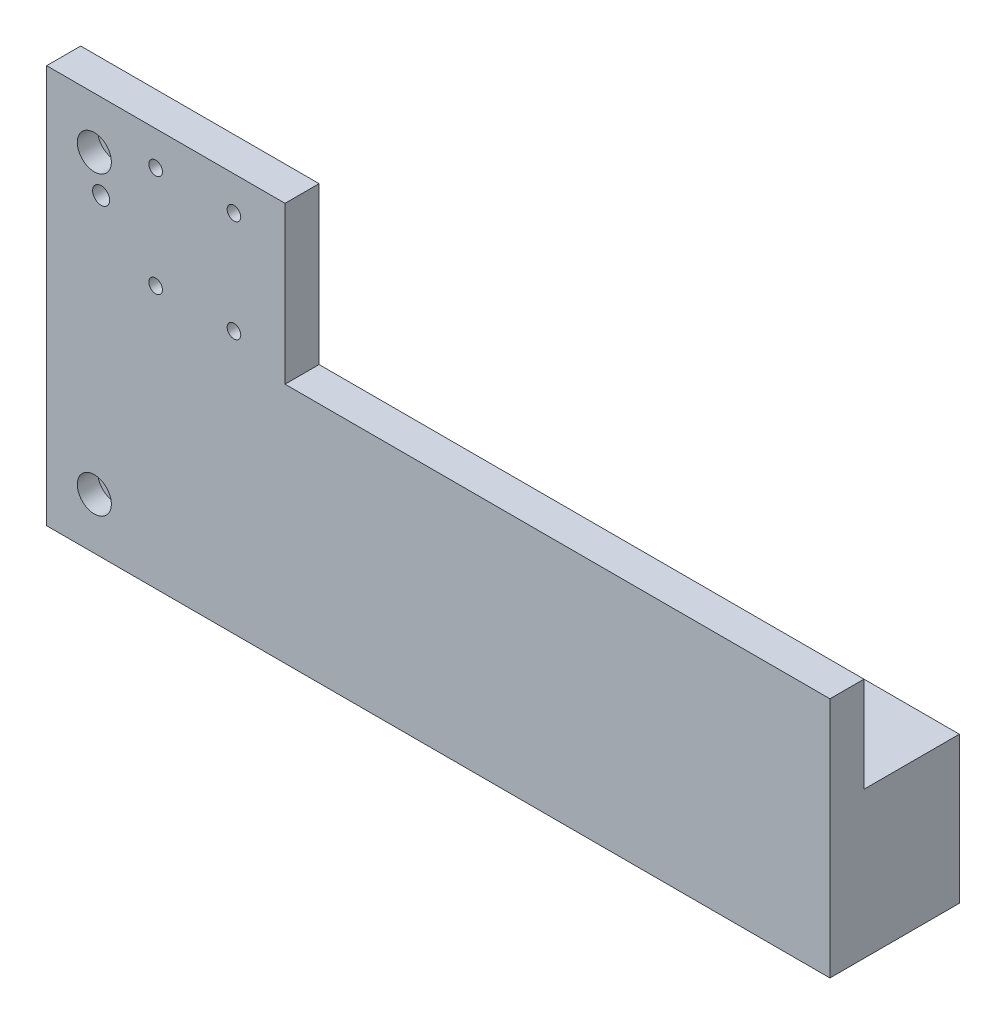
from build123d import *

# Parameters (mm, degrees)
SKETCH2_W           = 230
SKETCH2_H           = 120
BOSS_EXTRUDE1_DEPTH = 38
CUT_EXTRUDE1_DEPTH  = 28
SKETCH4_W           = 160
SKETCH4_H           = 46
CUT_EXTRUDE2_DEPTH  = 261.929109147
SKETCH5_R           = 3
CUT_EXTRUDE3_DEPTH  = 10
SKETCH9_W           = 276.739384021
SKETCH9_H           = 54.976414544
CUT_EXTRUDE5_DEPTH  = 263.190770242
SKETCH6_R           = 3
CUT_EXTRUDE4_DEPTH  = 260.563094449
SKETCH10_R          = 5
CUT_EXTRUDE6_DEPTH  = 6
SKETCH11_R          = 2
CUT_EXTRUDE7_DEPTH  = 261.831363145
SKETCH12_R          = 2.5
CUT_EXTRUDE8_DEPTH  = 261.831363145


with BuildPart() as part:
    # Sketch2 → Boss-Extrude1 (new body)
    with BuildSketch(Plane.XY):
        with Locations((115, -60)):
            Rectangle(SKETCH2_W, SKETCH2_H)
    extrude(amount=BOSS_EXTRUDE1_DEPTH)

    # Sketch3 → Cut-Extrude1 (cut)
    with BuildSketch(Plane.XY.offset(38)):
        Polygon((28, -120), (28, -74), (230, -74), (230, 0), (0, 0), (0, -120), align=None)
    extrude(amount=-CUT_EXTRUDE1_DEPTH, mode=Mode.SUBTRACT)

    # Sketch4 → Cut-Extrude2 (cut, through all)
    with BuildSketch(Plane.XY.offset(10)):
        with Locations((150, -23)):
            Rectangle(SKETCH4_W, SKETCH4_H)
    extrude(amount=-CUT_EXTRUDE2_DEPTH, mode=Mode.SUBTRACT)


with BuildPart() as body_2:
    # Mirror2: mirrored copy
    add(part.part.mirror(Plane(origin=(102.272727273, -73.454545455, 0), x_dir=(1, 0, 0), z_dir=(0, 0, -1))))

    # Sketch5 → Cut-Extrude3 (cut)
    with BuildSketch(Plane(origin=(0, -74, 0), x_dir=(1, 0, 0), z_dir=(0, 1, 0))):
        with Locations(Location((128, 24, 0), (0, 0, 270))):
            Circle(SKETCH5_R)
    extrude(amount=-CUT_EXTRUDE3_DEPTH, mode=Mode.SUBTRACT)

    # Sketch9 → Cut-Extrude5 (cut, through all)
    with BuildSketch(Plane(origin=(0, 0, -38), x_dir=(-1, 0, 0), z_dir=(0, 0, -1))):
        with Locations((-118.343160344, -144.488207272)):
            Rectangle(SKETCH9_W, SKETCH9_H)
    extrude(amount=-CUT_EXTRUDE5_DEPTH, mode=Mode.SUBTRACT)

    # Sketch6 → Cut-Extrude4 (cut, through all)
    with BuildSketch(Plane(origin=(0, 0, -10), x_dir=(-1, 0, 0), z_dir=(0, 0, -1))):
        with Locations((-14, -102)):
            Circle(SKETCH6_R)
        with Locations((-14, -15)):
            Circle(SKETCH6_R)
    extrude(amount=-CUT_EXTRUDE4_DEPTH, mode=Mode.SUBTRACT)

    # Sketch10 → Cut-Extrude6 (cut)
    with BuildSketch(Plane.XY):
        with Locations((14, -15)):
            Circle(SKETCH10_R)
        with Locations((14, -102)):
            Circle(SKETCH10_R)
    extrude(amount=-CUT_EXTRUDE6_DEPTH, mode=Mode.SUBTRACT)

    # Sketch11 → Cut-Extrude7 (cut, through all)
    with BuildSketch(Plane.XY):
        with Locations((55, -40)):
            Circle(SKETCH11_R)
        with Locations((55, -10)):
            Circle(SKETCH11_R)
        with Locations((32, -10)):
            Circle(SKETCH11_R)
        with Locations((32, -40)):
            Circle(SKETCH11_R)
    extrude(amount=-CUT_EXTRUDE7_DEPTH, mode=Mode.SUBTRACT)

    # Sketch12 → Cut-Extrude8 (cut, through all)
    with BuildSketch(Plane.XY):
        with Locations((16, -25)):
            Circle(SKETCH12_R)
    extrude(amount=-CUT_EXTRUDE8_DEPTH, mode=Mode.SUBTRACT)


solid = body_2.part
